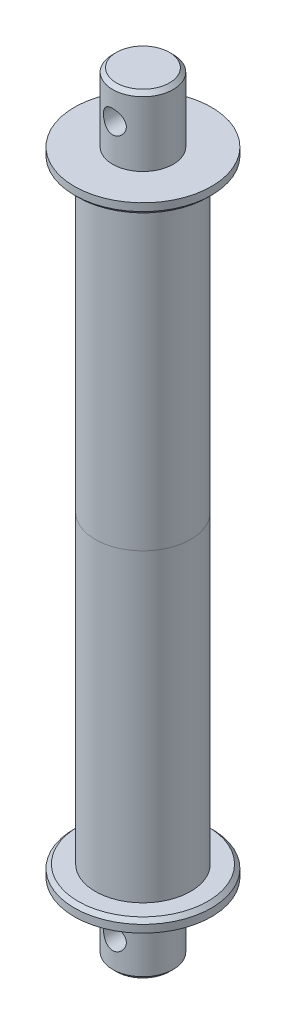
from build123d import *

# Parameters (mm, degrees)
SKETCH_1_R               = 7.95
EXTRUDE_1_DEPTH          = 18
CHAMFER_2_SIZE           = 1
CUT_EXTRUDE_2_DEPTH      = 22.22274723
CUT_EXTRUDE_2_DEPTH_BACK = 22.22274723
SKETCH_9_R               = 3
SKETCH_4_R               = 18
EXTRUDE_2_DEPTH          = 3
CHAMFER_1_SIZE           = 1
SKETCH_5_R               = 12.5
EXTRUDE_3_DEPTH          = 80


with BuildPart() as part:
    # 草图1 → 凸台-拉伸1 (new body)
    with BuildSketch(Plane(origin=(0, 0, 0), x_dir=(1, 0, 0), z_dir=(0, 1, 0))):
        with Locations(Location((0, 0, 0), (0, 0, 270))):
            Circle(SKETCH_1_R)
    extrude(amount=EXTRUDE_1_DEPTH)

    # 倒角2
    chamfer_2_edges = [part.edges().sort_by_distance(p)[0] for p in [
        (0, 18, -7.95),
    ]]
    chamfer(chamfer_2_edges, length=CHAMFER_2_SIZE)

    # 草图9 → 切除-拉伸2 (cut, two sides: drawn at the far end of the back side and taken through both)
    with BuildSketch(Plane.XY.offset(-CUT_EXTRUDE_2_DEPTH_BACK)):
        with Locations(Location((0, 9.7, 0), (0, 0, 89.999999999))):
            Circle(SKETCH_9_R)
    extrude(amount=CUT_EXTRUDE_2_DEPTH + CUT_EXTRUDE_2_DEPTH_BACK, mode=Mode.SUBTRACT)

    # 草图4 → 凸台-拉伸2 (add)
    with BuildSketch(Plane(origin=(0, 0, 0), x_dir=(1, 0, 0), z_dir=(0, 1, 0))):
        with Locations(Location((0, 0, 0), (0, 0, 270))):
            Circle(SKETCH_4_R)
    extrude(amount=-EXTRUDE_2_DEPTH)

    # 倒角1
    chamfer_1_edges = [part.edges().sort_by_distance(p)[0] for p in [
        (0, -3, -18),
    ]]
    chamfer(chamfer_1_edges, length=CHAMFER_1_SIZE)

    # 草图5 → 凸台-拉伸3 (add)
    with BuildSketch(Plane(origin=(0, -3, 0), x_dir=(-1, 0, 0), z_dir=(0, -1, 0))):
        with Locations(Location((0, 0, 0), (0, 0, 90))):
            Circle(SKETCH_5_R)
    extrude(amount=EXTRUDE_3_DEPTH)


with BuildPart() as body_2:
    # 镜向3: mirrored copy
    add(part.part.mirror(Plane(origin=(0, -83, 0), x_dir=(0, 0, 1), z_dir=(0, -1, 0))))


solid = Compound([part.part, body_2.part])
